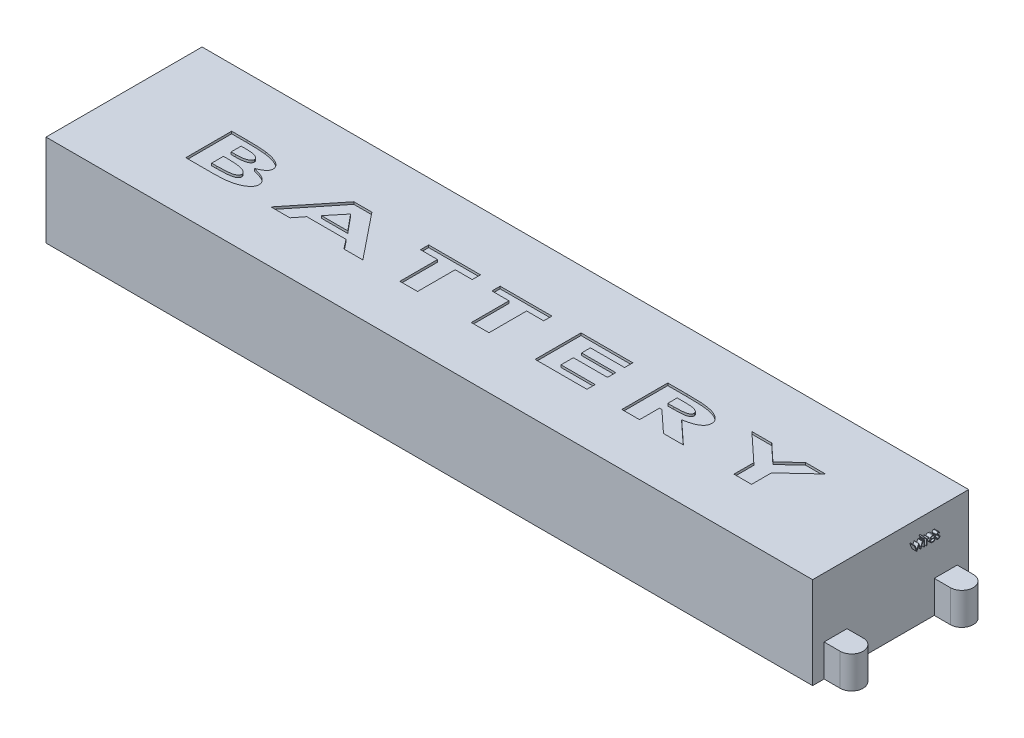
from build123d import *

# Parameters (mm, degrees)
SKETCH1_W           = 334
SKETCH1_H           = 68
BOSS_EXTRUDE1_DEPTH = 40
BOSS_EXTRUDE3_DEPTH = 14
SKETCH2_W           = 0.314102564
SKETCH2_H           = 2.557692308
BOSS_EXTRUDE2_DEPTH = 2
CUT_EXTRUDE1_DEPTH  = 1


with BuildPart() as part:
    # Sketch1 → Boss-Extrude1 (new body)
    with BuildSketch(Plane(origin=(0, 0, 0), x_dir=(1, 0, 0), z_dir=(0, 1, 0))):
        Rectangle(SKETCH1_W, SKETCH1_H)
    extrude(amount=BOSS_EXTRUDE1_DEPTH)

    # Sketch4 → Boss-Extrude3 (add)
    with BuildSketch(Plane(origin=(0, 0, 0), x_dir=(1, 0, 0), z_dir=(0, 1, 0))):
        with BuildLine():
            Line((167, -19), (174, -19))
            ThreePointArc((174, -19), (179, -24), (174, -29))
            Line((174, -29), (167, -29))
            Line((167, -29), (167, -19))
        make_face()
    boss_extrude3 = extrude(amount=BOSS_EXTRUDE3_DEPTH)

    # Mirror1: Boss-Extrude3 across plane
    add(boss_extrude3.mirror(Plane.XY))

    # Sketch2 → Boss-Extrude2 (add)
    # profile 1 of 6: a face of its own
    with BuildSketch(Plane(origin=(167, 0, 0), x_dir=(0, 0, -1), z_dir=(1, 0, 0))):
        Polygon((8.278846154, 32.557692308), (8.616085737, 32.557692308), (9.378205128, 30.717948718), (10.213241186, 32.557692308), (10.266526442, 32.557692308), (11.083333333, 30.717948718), (11.852463942, 32.557692308), (12.182692308, 32.557692308), (11.113481571, 30), (11.048277244, 30), (10.230769231, 31.83974359), (9.396434295, 30), (9.338241186, 30), align=None)
    # profile 2 of 6: a face of its own
    with BuildSketch(Plane(origin=(167, 0, 0), x_dir=(0, 0, -1), z_dir=(1, 0, 0))):
        with BuildLine():
            add(Edge.make_bspline(
                [(12.697315705, 33.634615385), (12.716807021, 33.633711232), (12.754974761, 33.631940728), (12.810168028, 33.616779251), (12.860425041, 33.591079566), (12.905002773, 33.556599885), (12.94325466, 33.516050441), (12.97003537, 33.468789473), (12.987247767, 33.417730834), (12.989326322, 33.382115745), (12.990384615, 33.363982372)],
                knots=[0, 0, 0, 0, 1.055194115, 2.066272739, 3.074728998, 4.095836921, 5.109056067, 6.073838105, 7.019297344, 8, 8, 8, 8], degree=3))
            add(Edge.make_bspline(
                [(12.990384615, 33.363982372), (12.989302456, 33.346319719), (12.987163154, 33.311402744), (12.970048665, 33.261229272), (12.943026428, 33.214624988), (12.905027302, 33.174154278), (12.860418541, 33.139693658), (12.810169755, 33.113988919), (12.754974307, 33.098828782), (12.716806867, 33.097058093), (12.697315705, 33.096153846)],
                knots=[0, 0, 0, 0, 0.96129708, 1.900370562, 2.859976407, 3.87933698, 4.906634145, 5.921202961, 6.938410037, 8, 8, 8, 8], degree=3))
            add(Edge.make_bspline(
                [(12.697315705, 33.096153846), (12.67804743, 33.097023566), (12.64054425, 33.098716363), (12.586177407, 33.114286381), (12.536348918, 33.139702454), (12.491684245, 33.173928639), (12.454454052, 33.214873536), (12.427355727, 33.26120083), (12.410280765, 33.311409985), (12.408136136, 33.346322151), (12.407051282, 33.363982372)],
                knots=[0, 0, 0, 0, 1.054934014, 2.053291228, 3.073705704, 4.106921865, 5.123545215, 6.088680038, 7.033164197, 8, 8, 8, 8], degree=3))
            add(Edge.make_bspline(
                [(12.407051282, 33.363982372), (12.408112369, 33.382113221), (12.41019641, 33.417723354), (12.427368526, 33.468818387), (12.454228334, 33.515799889), (12.491708897, 33.556825388), (12.536342357, 33.591070823), (12.586179103, 33.616481804), (12.640543802, 33.632053144), (12.678047278, 33.633745758), (12.697315705, 33.634615385)],
                knots=[0, 0, 0, 0, 0.98631895, 1.937192651, 2.907499808, 3.917963147, 4.944918757, 5.95915025, 6.951458133, 8, 8, 8, 8], degree=3))
        make_face()
    # profile 3 of 6: a face of its own
    with BuildSketch(Plane(origin=(167, 0, 0), x_dir=(0, 0, -1), z_dir=(1, 0, 0))):
        with Locations((12.698717949, 31.278846154)):
            Rectangle(SKETCH2_W, SKETCH2_H)
    # profile 4 of 6: a face of its own
    with BuildSketch(Plane(origin=(167, 0, 0), x_dir=(0, 0, -1), z_dir=(1, 0, 0))):
        with BuildLine():
            Line((13.528846154, 32.557692308), (13.842948718, 32.557692308))
            Line((13.842948718, 32.557692308), (13.842948718, 32.181189904))
            add(Edge.make_bspline(
                [(13.842948718, 32.181189904), (13.866137477, 32.216245732), (13.910485798, 32.283289731), (13.984198727, 32.371959032), (14.059702058, 32.445374079), (14.137357246, 32.503877598), (14.217735345, 32.547690717), (14.299072297, 32.579783752), (14.382647767, 32.598761067), (14.438809691, 32.601294726), (14.466947115, 32.602564103)],
                knots=[0, 0, 0, 0, 1.2804753, 2.448899062, 3.506932113, 4.484331642, 5.4025378, 6.288909075, 7.142734305, 8, 8, 8, 8], degree=3))
            add(Edge.make_bspline(
                [(14.466947115, 32.602564103), (14.488773442, 32.601373576), (14.533682527, 32.59892399), (14.601665117, 32.581713165), (14.671708569, 32.554235143), (14.716850956, 32.52839492), (14.740384615, 32.514923878)],
                knots=[0, 0, 0, 0, 0.901110191, 1.854092781, 2.881294221, 4, 4, 4, 4], degree=3))
            Line((14.740384615, 32.514923878), (14.567908654, 32.242888622))
            add(Edge.make_bspline(
                [(14.567908654, 32.242888622), (14.552799633, 32.249628888), (14.524119818, 32.262423203), (14.482165252, 32.277565213), (14.443483915, 32.286481129), (14.418840357, 32.287831847), (14.407351763, 32.288461538)],
                knots=[0, 0, 0, 0, 1.180555205, 2.24091978, 3.179933427, 4, 4, 4, 4], degree=3))
            add(Edge.make_bspline(
                [(14.407351763, 32.288461538), (14.382146029, 32.286781501), (14.330733639, 32.283354712), (14.25524914, 32.256415904), (14.182001934, 32.212890664), (14.123830272, 32.164619552), (14.078788019, 32.118071755), (14.046647794, 32.077423352), (14.017165047, 32.031844721), (13.988994826, 31.982115037), (13.963328532, 31.927385191), (13.939373863, 31.868201977), (13.917715, 31.804496849), (13.905364756, 31.760114328), (13.899038462, 31.737379808)],
                knots=[0, 0, 0, 0, 1.125678352, 2.296057538, 3.5422874, 4.923748041, 5.663163013, 6.437101912, 7.23742474, 8.08941207, 8.991984279, 9.93940061, 10.944477711, 12, 12, 12, 12], degree=3))
            add(Edge.make_bspline(
                [(13.899038462, 31.737379808), (13.894306068, 31.717102634), (13.883824176, 31.672190235), (13.873632639, 31.596841711), (13.863563121, 31.507818052), (13.856466502, 31.404871459), (13.84988846, 31.288259015), (13.846178378, 31.15780307), (13.843075237, 31.013369718), (13.842992171, 30.912395365), (13.842948718, 30.859575321)],
                knots=[0, 0, 0, 0, 0.566838948, 1.255505196, 2.06880316, 3.007127437, 4.065329342, 5.249902469, 6.561414163, 8, 8, 8, 8], degree=3))
            Line((13.842948718, 30.859575321), (13.842948718, 30))
            Line((13.842948718, 30), (13.528846154, 30))
            Line((13.528846154, 30), (13.528846154, 32.557692308))
        make_face()
    # profile 5 of 6: a face of its own
    with BuildSketch(Plane(origin=(167, 0, 0), x_dir=(0, 0, -1), z_dir=(1, 0, 0))):
        with BuildLine():
            Line((17.153645833, 30.807692308), (17.432692308, 30.661157853))
            add(Edge.make_bspline(
                [(17.432692308, 30.661157853), (17.410455712, 30.621714521), (17.367192104, 30.544973418), (17.292791356, 30.439541558), (17.214799283, 30.344693842), (17.129695315, 30.262964188), (17.040025637, 30.191712803), (16.945292982, 30.129374978), (16.845004164, 30.076256458), (16.739154439, 30.03150393), (16.626854888, 29.997094436), (16.507833372, 29.972790215), (16.381861876, 29.957766946), (16.295515696, 29.956021806), (16.251302083, 29.955128205)],
                knots=[0, 0, 0, 0, 1.120438281, 2.179929193, 3.190490725, 4.156257408, 5.095198341, 6.022838206, 6.959905092, 7.901321166, 8.864066838, 9.862729781, 10.905609505, 12, 12, 12, 12], degree=3))
            add(Edge.make_bspline(
                [(16.251302083, 29.955128205), (16.202160106, 29.95627538), (16.106298344, 29.958513187), (15.966758597, 29.977805652), (15.835379179, 30.00927801), (15.712167475, 30.053243552), (15.597425223, 30.110670876), (15.490924368, 30.180630358), (15.392104842, 30.262762612), (15.304080633, 30.357779056), (15.22483675, 30.459461013), (15.15491093, 30.565416898), (15.096453499, 30.675380122), (15.048900889, 30.788650646), (15.010496024, 30.90451454), (14.98372932, 31.024026007), (14.968299572, 31.146861592), (14.965935127, 31.229958927), (14.96474359, 31.271834936)],
                knots=[0, 0, 0, 0, 1.145258523, 2.234067595, 3.276747158, 4.290159414, 5.277019952, 6.260822364, 7.254936242, 8.264827045, 9.274100331, 10.257902744, 11.220704747, 12.172965371, 13.118907548, 14.062713208, 15.023725156, 16, 16, 16, 16], degree=3))
            add(Edge.make_bspline(
                [(14.96474359, 31.271834936), (14.965802731, 31.311129766), (14.967901809, 31.389006931), (14.981132597, 31.504272476), (15.00458089, 31.616300928), (15.036757214, 31.725185376), (15.07830846, 31.83074351), (15.129140679, 31.933039574), (15.189333057, 32.031964713), (15.235805731, 32.094367847), (15.259214744, 32.125801282)],
                knots=[0, 0, 0, 0, 1.024358464, 2.0301432, 3.019427413, 4.004406732, 4.986367066, 5.972626655, 6.978780325, 8, 8, 8, 8], degree=3))
            add(Edge.make_bspline(
                [(15.259214744, 32.125801282), (15.290922426, 32.163670152), (15.353333373, 32.238208303), (15.458889728, 32.336146628), (15.573189925, 32.418190404), (15.694801551, 32.48619754), (15.825138025, 32.537871187), (15.962447316, 32.576378769), (16.108292902, 32.59795678), (16.207998123, 32.601004614), (16.259014423, 32.602564103)],
                knots=[0, 0, 0, 0, 1.030682036, 2.02871468, 2.997146059, 3.962720338, 4.930598197, 5.918074684, 6.934738563, 8, 8, 8, 8], degree=3))
            add(Edge.make_bspline(
                [(16.259014423, 32.602564103), (16.311462028, 32.601210054), (16.414352274, 32.598553718), (16.564384395, 32.573927385), (16.706345112, 32.53487483), (16.840177616, 32.47972104), (16.965895477, 32.408561488), (17.082681527, 32.320419647), (17.192533039, 32.218001559), (17.256441618, 32.13923835), (17.28896234, 32.099158654)],
                knots=[0, 0, 0, 0, 1.056321875, 2.072262726, 3.055038591, 4.01806755, 4.982017516, 5.957941055, 6.960871419, 8, 8, 8, 8], degree=3))
            add(Edge.make_bspline(
                [(17.28896234, 32.099158654), (17.311089278, 32.068955072), (17.355195871, 32.008748954), (17.410442971, 31.910577797), (17.458400366, 31.807867202), (17.496733327, 31.698956905), (17.527772828, 31.585137325), (17.550229647, 31.46559478), (17.563399266, 31.340364869), (17.565987963, 31.255038314), (17.567307692, 31.211538462)],
                knots=[0, 0, 0, 0, 0.94817472, 1.890038105, 2.849395472, 3.817997239, 4.812318967, 5.836947057, 6.897266129, 8, 8, 8, 8], degree=3))
            Line((17.567307692, 31.211538462), (15.278846154, 31.211538462))
            add(Edge.make_bspline(
                [(15.278846154, 31.211538462), (15.28038576, 31.177837997), (15.283413334, 31.111567394), (15.297528477, 31.01459661), (15.319777251, 30.922223268), (15.351046314, 30.835140226), (15.388913159, 30.752210099), (15.435298876, 30.674048062), (15.49063843, 30.601010132), (15.552364129, 30.532442994), (15.621071225, 30.471382233), (15.693353972, 30.416730457), (15.770247537, 30.37092486), (15.85114562, 30.33374497), (15.935917405, 30.304638654), (16.0245896, 30.284770834), (16.116987717, 30.271463727), (16.179973451, 30.269984061), (16.212039263, 30.269230769)],
                knots=[0, 0, 0, 0, 1.094153842, 2.151609401, 3.174256925, 4.172055639, 5.149267565, 6.128595816, 7.11444997, 8.118368179, 9.117203808, 10.09244225, 11.054858984, 12.015122123, 12.976791628, 13.957293641, 14.960065497, 16, 16, 16, 16], degree=3))
            add(Edge.make_bspline(
                [(16.212039263, 30.269230769), (16.24339041, 30.269838826), (16.305597101, 30.271045327), (16.398237959, 30.282777238), (16.489377486, 30.301747513), (16.578638469, 30.327637504), (16.664209315, 30.359214356), (16.743454865, 30.397317213), (16.816335081, 30.43946696), (16.884452048, 30.487676635), (16.950523041, 30.546684822), (17.016065527, 30.620320543), (17.086342181, 30.707408071), (17.130331773, 30.772953737), (17.153645833, 30.807692308)],
                knots=[0, 0, 0, 0, 0.99110716, 1.966546729, 2.947904876, 3.932708344, 4.903319531, 5.828989031, 6.710028674, 7.56322171, 8.463672341, 9.504779593, 10.677557249, 12, 12, 12, 12], degree=3))
        make_face()
        with BuildLine():
            add(Edge.make_bspline(
                [(17.253205128, 31.525641026), (17.241708504, 31.567303899), (17.219581202, 31.64749152), (17.173344838, 31.75853241), (17.121273297, 31.857220311), (17.059651566, 31.942799944), (16.98983284, 32.018803457), (16.909187657, 32.085222043), (16.818751764, 32.144639494), (16.718992623, 32.194791993), (16.613350838, 32.237481852), (16.502744646, 32.266106968), (16.389886858, 32.28571651), (16.313552572, 32.287542618), (16.275140224, 32.288461538)],
                knots=[0, 0, 0, 0, 1.154881502, 2.222775134, 3.210006277, 4.132804581, 5.035138423, 5.962687519, 6.919655026, 7.923214229, 8.944639381, 9.960483929, 10.97369054, 12, 12, 12, 12], degree=3))
            add(Edge.make_bspline(
                [(16.275140224, 32.288461538), (16.243790786, 32.287849867), (16.181819537, 32.286640721), (16.090518469, 32.275170592), (16.00283877, 32.256210747), (15.918133482, 32.23024579), (15.837512614, 32.195637188), (15.759317845, 32.155053961), (15.685537449, 32.105512377), (15.639396154, 32.067753522), (15.616085737, 32.048677885)],
                knots=[0, 0, 0, 0, 1.04873581, 2.073130211, 3.073294108, 4.04793562, 5.032784715, 6.005352987, 6.992311501, 8, 8, 8, 8], degree=3))
            add(Edge.make_bspline(
                [(15.616085737, 32.048677885), (15.599392455, 32.033583569), (15.565609321, 32.003036353), (15.520468799, 31.950407146), (15.477248327, 31.893655584), (15.437914674, 31.83061046), (15.401837088, 31.761989681), (15.36807711, 31.688372045), (15.337690698, 31.609198915), (15.320594588, 31.554026476), (15.311798878, 31.525641026)],
                knots=[0, 0, 0, 0, 0.879870761, 1.780643979, 2.707998968, 3.669668524, 4.684282772, 5.740141944, 6.837334558, 8, 8, 8, 8], degree=3))
            Line((15.311798878, 31.525641026), (17.253205128, 31.525641026))
        make_face(mode=Mode.SUBTRACT)
    # profile 6 of 6: a face of its own
    with BuildSketch(Plane(origin=(167, 0, 0), x_dir=(0, 0, -1), z_dir=(1, 0, 0))):
        with BuildLine():
            Line((19.407051282, 32.238681891), (19.193910256, 32.019230769))
            add(Edge.make_bspline(
                [(19.193910256, 32.019230769), (19.175519753, 32.040543916), (19.140065027, 32.081633153), (19.083833546, 32.136570219), (19.027809943, 32.182707158), (18.972761129, 32.221659417), (18.91730286, 32.251108564), (18.862085942, 32.272603426), (18.807053203, 32.285905231), (18.770267168, 32.28761967), (18.752203526, 32.288461538)],
                knots=[0, 0, 0, 0, 1.26578478, 2.440284043, 3.530471711, 4.527705817, 5.468200915, 6.346673037, 7.188140097, 8, 8, 8, 8], degree=3))
            add(Edge.make_bspline(
                [(18.752203526, 32.288461538), (18.730064136, 32.287386665), (18.68649695, 32.285271468), (18.624071132, 32.264158037), (18.566120507, 32.231749299), (18.515963527, 32.185780715), (18.473475846, 32.133016446), (18.442462165, 32.074020122), (18.423496182, 32.010572078), (18.42109145, 31.96654222), (18.419871795, 31.944210737)],
                knots=[0, 0, 0, 0, 0.99966794, 1.967205029, 2.953328237, 3.988086729, 5.028030931, 6.008226631, 6.989793394, 8, 8, 8, 8], degree=3))
            add(Edge.make_bspline(
                [(18.419871795, 31.944210737), (18.420982607, 31.923998693), (18.4232011, 31.883631582), (18.44044778, 31.824083548), (18.467913852, 31.76602651), (18.493584046, 31.730463604), (18.506810897, 31.712139423)],
                knots=[0, 0, 0, 0, 0.960159726, 1.917612774, 2.927026955, 4, 4, 4, 4], degree=3))
            add(Edge.make_bspline(
                [(18.506810897, 31.712139423), (18.514774391, 31.702354839), (18.531723684, 31.681529584), (18.563532199, 31.652625731), (18.599554702, 31.62068348), (18.64287464, 31.588746643), (18.691625667, 31.555114918), (18.746864952, 31.521112785), (18.806839457, 31.48414836), (18.849776763, 31.460703924), (18.872095353, 31.448517628)],
                knots=[0, 0, 0, 0, 0.66740084, 1.420478572, 2.27185888, 3.217733974, 4.268547843, 5.408967954, 6.65319498, 8, 8, 8, 8], degree=3))
            add(Edge.make_bspline(
                [(18.872095353, 31.448517628), (18.89930893, 31.433272725), (18.9518766, 31.403824593), (19.026569367, 31.358114889), (19.094356408, 31.312683465), (19.155812076, 31.268016191), (19.209753884, 31.222863324), (19.257818437, 31.178955567), (19.298806881, 31.134966258), (19.321760808, 31.104233145), (19.332732372, 31.089543269)],
                knots=[0, 0, 0, 0, 1.27191281, 2.456916733, 3.569705269, 4.599008579, 5.553216877, 6.436649441, 7.252746552, 8, 8, 8, 8], degree=3))
            add(Edge.make_bspline(
                [(19.332732372, 31.089543269), (19.350942899, 31.059877181), (19.387185229, 31.00083616), (19.425243495, 30.903617733), (19.44730377, 30.80050723), (19.45036599, 30.72997501), (19.451923077, 30.694110577)],
                knots=[0, 0, 0, 0, 0.995354457, 1.980940102, 2.973342416, 4, 4, 4, 4], degree=3))
            add(Edge.make_bspline(
                [(19.451923077, 30.694110577), (19.451203543, 30.668841431), (19.449785623, 30.619045818), (19.439927556, 30.545710988), (19.42297258, 30.47557643), (19.399878826, 30.407881146), (19.368694453, 30.343922206), (19.332146656, 30.282085957), (19.288271744, 30.223710026), (19.238180368, 30.168871066), (19.183334875, 30.118785319), (19.124828736, 30.074761365), (19.062589906, 30.038187028), (18.997063104, 30.007921682), (18.92809945, 29.983853424), (18.855688161, 29.967190893), (18.780059406, 29.957218132), (18.728629598, 29.955833656), (18.702423878, 29.955128205)],
                knots=[0, 0, 0, 0, 1.032770009, 2.035186124, 3.017557409, 3.978232242, 4.952395191, 5.920591857, 6.910227898, 7.931268572, 8.952309245, 9.941945286, 10.918353717, 11.897095711, 12.887975737, 13.898235213, 14.929059601, 16, 16, 16, 16], degree=3))
            add(Edge.make_bspline(
                [(18.702423878, 29.955128205), (18.667056703, 29.956120905), (18.596813776, 29.958092513), (18.492924057, 29.976598574), (18.391403298, 30.005393968), (18.293019758, 30.045109902), (18.199973644, 30.095260615), (18.114842719, 30.155323008), (18.037331257, 30.223313006), (17.993212983, 30.275425916), (17.971153846, 30.301482372)],
                knots=[0, 0, 0, 0, 1.013940152, 2.01379169, 3.017749504, 4.037548394, 5.051665909, 6.043208538, 7.021604269, 8, 8, 8, 8], degree=3))
            Line((17.971153846, 30.301482372), (18.179387019, 30.538461538))
            add(Edge.make_bspline(
                [(18.179387019, 30.538461538), (18.199159432, 30.517106774), (18.237491244, 30.475707334), (18.298792461, 30.420582993), (18.361171862, 30.374381722), (18.424006549, 30.335738307), (18.488226643, 30.305962904), (18.553472257, 30.28504431), (18.619610682, 30.271600118), (18.664032817, 30.270021836), (18.686298077, 30.269230769)],
                knots=[0, 0, 0, 0, 1.179806542, 2.287233372, 3.337373186, 4.324005949, 5.273901747, 6.200048787, 7.097828587, 8, 8, 8, 8], degree=3))
            add(Edge.make_bspline(
                [(18.686298077, 30.269230769), (18.716616003, 30.270601594), (18.775852144, 30.273279956), (18.860695903, 30.297597048), (18.93903453, 30.335727), (19.007057875, 30.389811698), (19.064960036, 30.452767271), (19.106888211, 30.52368139), (19.133164386, 30.600472847), (19.136250385, 30.653705149), (19.137820513, 30.680789263)],
                knots=[0, 0, 0, 0, 1.072336372, 2.095165389, 3.102688358, 4.141489647, 5.156069229, 6.117746104, 7.042326257, 8, 8, 8, 8], degree=3))
            add(Edge.make_bspline(
                [(19.137820513, 30.680789263), (19.136734218, 30.703098881), (19.134589476, 30.747146237), (19.117746204, 30.810896578), (19.091133351, 30.871365859), (19.064928703, 30.906755506), (19.051582532, 30.924779647)],
                knots=[0, 0, 0, 0, 1.013901739, 2.00181326, 2.98231254, 4, 4, 4, 4], degree=3))
            add(Edge.make_bspline(
                [(19.051582532, 30.924779647), (19.043560138, 30.93381501), (19.026084465, 30.953497292), (18.994029224, 30.98192237), (18.955647362, 31.01256047), (18.910507199, 31.044892059), (18.858517737, 31.078490664), (18.799468261, 31.113180016), (18.734167709, 31.150607742), (18.687997078, 31.175427397), (18.663862179, 31.188401442)],
                knots=[0, 0, 0, 0, 0.615000592, 1.339693406, 2.178160186, 3.116406724, 4.166410947, 5.330106347, 6.604359322, 8, 8, 8, 8], degree=3))
            add(Edge.make_bspline(
                [(18.663862179, 31.188401442), (18.637815539, 31.202940574), (18.587302792, 31.23113659), (18.515755501, 31.275052671), (18.451208147, 31.319719945), (18.392107572, 31.362632784), (18.339946567, 31.406053728), (18.294930618, 31.45003098), (18.255287402, 31.492790966), (18.233339991, 31.523088263), (18.222856571, 31.537560096)],
                knots=[0, 0, 0, 0, 1.262093308, 2.447601706, 3.550203992, 4.582594899, 5.537233252, 6.418365656, 7.244515135, 8, 8, 8, 8], degree=3))
            add(Edge.make_bspline(
                [(18.222856571, 31.537560096), (18.204725971, 31.566705711), (18.168458436, 31.625007126), (18.133243244, 31.722317603), (18.109037216, 31.824762661), (18.106874825, 31.895449515), (18.105769231, 31.931590545)],
                knots=[0, 0, 0, 0, 0.985009483, 1.970363186, 2.962279964, 4, 4, 4, 4], degree=3))
            add(Edge.make_bspline(
                [(18.105769231, 31.931590545), (18.106303426, 31.955215943), (18.107348922, 32.001454194), (18.115692974, 32.069393014), (18.130884685, 32.133941168), (18.149939607, 32.196068031), (18.176422612, 32.254570125), (18.208068517, 32.310227596), (18.245255942, 32.362963514), (18.288099233, 32.411966646), (18.335205878, 32.456475972), (18.386100648, 32.4952746), (18.439638904, 32.528380955), (18.496047324, 32.556146116), (18.555867797, 32.577147498), (18.618682183, 32.591604883), (18.684363338, 32.601260086), (18.729264464, 32.602123171), (18.752203526, 32.602564103)],
                knots=[0, 0, 0, 0, 1.087655834, 2.128696564, 3.144119009, 4.137814668, 5.115653402, 6.093965665, 7.082169637, 8.081268856, 9.086088321, 10.061021666, 11.022561449, 11.980240094, 12.950172527, 13.934149372, 14.944599409, 16, 16, 16, 16], degree=3))
            add(Edge.make_bspline(
                [(18.752203526, 32.602564103), (18.779395589, 32.601459762), (18.834289811, 32.599230364), (18.916644437, 32.581524674), (18.998877779, 32.552391569), (19.081201129, 32.512155336), (19.163011418, 32.46008846), (19.245028275, 32.397159161), (19.328236305, 32.323781446), (19.380192618, 32.267682221), (19.407051282, 32.238681891)],
                knots=[0, 0, 0, 0, 0.845714091, 1.707292901, 2.609013841, 3.555613372, 4.552488639, 5.621697636, 6.770543573, 8, 8, 8, 8], degree=3))
        make_face()
    extrude(amount=BOSS_EXTRUDE2_DEPTH)

    # Sketch3 → Cut-Extrude1 (cut)
    # profile 1 of 7: a face of its own
    with BuildSketch(Plane(origin=(0, 40, 0), x_dir=(1, 0, 0), z_dir=(0, 1, 0))):
        with BuildLine():
            Line((-128.769230769, -11.333333333), (-128.769230769, 8.666666667))
            Line((-128.769230769, 8.666666667), (-122.138621795, 8.666666667))
            add(Edge.make_bspline(
                [(-122.138621795, 8.666666667), (-121.673868202, 8.666710349), (-120.776363255, 8.666794706), (-119.479598107, 8.644619916), (-118.279002801, 8.616498), (-117.175550768, 8.584284762), (-116.168704241, 8.529835025), (-115.260241877, 8.472029716), (-114.447742763, 8.402035062), (-113.940021711, 8.33951429), (-113.701121795, 8.310096154)],
                knots=[0, 0, 0, 0, 1.31998214, 2.549072282, 3.683500943, 4.730935446, 5.684263683, 6.547160721, 7.316390013, 8, 8, 8, 8], degree=3))
            add(Edge.make_bspline(
                [(-113.701121795, 8.310096154), (-113.393565068, 8.268604856), (-112.792635807, 8.187535796), (-111.919007274, 8.025502368), (-111.091768499, 7.841286884), (-110.312180795, 7.636710818), (-109.582330759, 7.398546569), (-108.901569636, 7.134955432), (-108.267047961, 6.84681245), (-107.683659307, 6.537052778), (-107.158508721, 6.206781648), (-106.700305314, 5.85921377), (-106.310074219, 5.498334926), (-105.993304393, 5.118601701), (-105.746143146, 4.723646464), (-105.565445056, 4.314467501), (-105.457345924, 3.887211145), (-105.443073171, 3.596485185), (-105.435897436, 3.450320513)],
                knots=[0, 0, 0, 0, 1.444239864, 2.821872898, 4.133831976, 5.388239239, 6.571533518, 7.705033956, 8.784268754, 9.813142222, 10.777069403, 11.668425098, 12.486344434, 13.245570479, 13.963067819, 14.647834093, 15.320188377, 16, 16, 16, 16], degree=3))
            add(Edge.make_bspline(
                [(-105.435897436, 3.450320513), (-105.438888653, 3.355287434), (-105.44482579, 3.166660394), (-105.495478226, 2.887122704), (-105.575121064, 2.614069146), (-105.688596966, 2.348137995), (-105.834556803, 2.088532569), (-106.015789574, 1.838224556), (-106.22627099, 1.591866323), (-106.467236552, 1.350406603), (-106.747187437, 1.115518927), (-107.069549574, 0.890862451), (-107.424806028, 0.659783128), (-107.826129255, 0.44135007), (-108.264132119, 0.219840706), (-108.746959339, 0.011519705), (-109.264609316, -0.204642144), (-109.62733528, -0.335947222), (-109.814903846, -0.403846154)],
                knots=[0, 0, 0, 0, 0.73412892, 1.457140681, 2.188870362, 2.928999352, 3.687054493, 4.486307402, 5.313796769, 6.189772561, 7.120317905, 8.134385744, 9.225455312, 10.39460865, 11.664228043, 13.018493101, 14.458238366, 16, 16, 16, 16], degree=3))
            add(Edge.make_bspline(
                [(-109.814903846, -0.403846154), (-109.513950512, -0.475427717), (-108.929925472, -0.614337709), (-108.08942069, -0.846768876), (-107.309326508, -1.08972295), (-106.592879759, -1.349445313), (-105.938647222, -1.621172777), (-105.346622579, -1.903641002), (-104.820156442, -2.205327239), (-104.352638749, -2.516753273), (-103.943893428, -2.843945545), (-103.58809847, -3.183490182), (-103.290877036, -3.542680859), (-103.041480465, -3.912238985), (-102.85328081, -4.300246965), (-102.713915871, -4.700290175), (-102.632174814, -5.117417754), (-102.621021739, -5.400826555), (-102.615384615, -5.544070513)],
                knots=[0, 0, 0, 0, 1.560057579, 3.027421822, 4.397137032, 5.679779435, 6.869333915, 7.968857049, 8.985549996, 9.927045053, 10.799049465, 11.623096799, 12.402674743, 13.146153443, 13.86607283, 14.571093087, 15.277784314, 16, 16, 16, 16], degree=3))
            add(Edge.make_bspline(
                [(-102.615384615, -5.544070513), (-102.620836364, -5.682023659), (-102.631735767, -5.957826363), (-102.718768396, -6.367155202), (-102.865350153, -6.764408589), (-103.064882598, -7.154999787), (-103.321357332, -7.534678038), (-103.640453062, -7.902276573), (-104.012576709, -8.260557292), (-104.437415999, -8.608733618), (-104.908108205, -8.935332663), (-105.409654817, -9.251558883), (-105.949337855, -9.538610299), (-106.520252449, -9.806223726), (-107.12502911, -10.0514009), (-107.761862984, -10.274422458), (-108.430968423, -10.479616505), (-109.139674916, -10.660378172), (-109.898179993, -10.823359412), (-110.721333903, -10.954695371), (-111.608897842, -11.078697989), (-112.567859605, -11.165367347), (-113.593364032, -11.244083004), (-114.68899222, -11.293159981), (-115.851024291, -11.326190747), (-116.648478635, -11.330907957), (-117.05849359, -11.333333333)],
                knots=[0, 0, 0, 0, 0.590042084, 1.17964111, 1.781712407, 2.397728595, 3.052407878, 3.737419508, 4.477092177, 5.260849838, 6.08539125, 6.92749391, 7.796908267, 8.699467972, 9.624953763, 10.588414995, 11.586399601, 12.619129434, 13.717672503, 14.90533072, 16.185677954, 17.552275451, 19.025136816, 20.58720367, 22.245294487, 24, 24, 24, 24], degree=3))
            Line((-117.05849359, -11.333333333), (-128.769230769, -11.333333333))
        make_face()
        with BuildLine():
            Line((-121.076923077, 5.076923077), (-121.076923077, 0.717948718))
            Line((-121.076923077, 0.717948718), (-119.225961538, 0.717948718))
            add(Edge.make_bspline(
                [(-119.225961538, 0.717948718), (-118.976199322, 0.719057602), (-118.493863352, 0.721199059), (-117.79505089, 0.749641591), (-117.145477027, 0.796307137), (-116.545574003, 0.864678889), (-115.994349272, 0.947108813), (-115.493555697, 1.049499396), (-115.042959971, 1.174161866), (-114.640738326, 1.313153767), (-114.286041758, 1.468384708), (-113.978281015, 1.641136044), (-113.718210262, 1.827313217), (-113.503270405, 2.026549031), (-113.336341959, 2.241440112), (-113.212839281, 2.470577389), (-113.142932035, 2.717150925), (-113.133138085, 2.885006709), (-113.128205128, 2.969551282)],
                knots=[0, 0, 0, 0, 1.704654372, 3.291995604, 4.772716245, 6.148760897, 7.412139669, 8.575936087, 9.635231733, 10.600978065, 11.478367912, 12.274325297, 13.005481925, 13.656761961, 14.267553572, 14.854693493, 15.423139034, 16, 16, 16, 16], degree=3))
            add(Edge.make_bspline(
                [(-113.128205128, 2.969551282), (-113.133471912, 3.048696227), (-113.143911037, 3.20556692), (-113.208220428, 3.435018858), (-113.326667562, 3.646890314), (-113.482966789, 3.848967378), (-113.689821733, 4.032979387), (-113.934483062, 4.211736704), (-114.229622919, 4.367543598), (-114.564216973, 4.518501666), (-114.945807273, 4.648056105), (-115.372643036, 4.764068887), (-115.846013466, 4.863973507), (-116.366443518, 4.942692251), (-116.933437357, 5.001383227), (-117.54542053, 5.044376303), (-118.204039905, 5.073891338), (-118.658352054, 5.075889273), (-118.893429487, 5.076923077)],
                knots=[0, 0, 0, 0, 0.573248763, 1.13621826, 1.707098723, 2.320047212, 2.976781728, 3.703807878, 4.508430471, 5.386834626, 6.358951356, 7.421225169, 8.587157953, 9.858551474, 11.229180048, 12.711929957, 14.298634394, 16, 16, 16, 16], degree=3))
            Line((-118.893429487, 5.076923077), (-121.076923077, 5.076923077))
        make_face(mode=Mode.SUBTRACT)
        with BuildLine():
            Line((-121.076923077, -2.615384615), (-121.076923077, -7.743589744))
            Line((-121.076923077, -7.743589744), (-119.009615385, -7.743589744))
            add(Edge.make_bspline(
                [(-119.009615385, -7.743589744), (-118.599610936, -7.742461888), (-117.814217086, -7.740301398), (-116.688135035, -7.71284272), (-115.666326276, -7.664660765), (-114.748287476, -7.6029358), (-113.935381769, -7.521467269), (-113.227161354, -7.416829647), (-112.622291047, -7.30224352), (-112.112995328, -7.160865499), (-111.687439479, -6.997598966), (-111.320570087, -6.826229381), (-111.009119164, -6.635141016), (-110.754766725, -6.42356481), (-110.555183826, -6.194228932), (-110.412595543, -5.947254806), (-110.323287595, -5.68090715), (-110.312917004, -5.496666475), (-110.307692308, -5.403846154)],
                knots=[0, 0, 0, 0, 2.042760453, 3.913058762, 5.611655864, 7.13909107, 8.497020976, 9.680799424, 10.705160778, 11.562468973, 12.310096949, 12.973778225, 13.577516776, 14.125315016, 14.616075177, 15.084022435, 15.538531152, 16, 16, 16, 16], degree=3))
            add(Edge.make_bspline(
                [(-110.307692308, -5.403846154), (-110.313257964, -5.297460726), (-110.324298497, -5.086425087), (-110.432562481, -4.782498116), (-110.600381513, -4.497757696), (-110.833216425, -4.231290324), (-111.132272772, -3.985445707), (-111.496053359, -3.759009609), (-111.924400259, -3.547006763), (-112.421082572, -3.350368626), (-112.994127167, -3.174355608), (-113.650414006, -3.024178608), (-114.391594598, -2.897833257), (-115.219388528, -2.796557533), (-116.133018976, -2.710641267), (-117.134167093, -2.659536811), (-118.221389258, -2.62108716), (-118.974852747, -2.617333953), (-119.366185897, -2.615384615)],
                knots=[0, 0, 0, 0, 0.501495216, 0.994810717, 1.507164792, 2.057939335, 2.658765087, 3.331591524, 4.080080005, 4.916289717, 5.85519198, 6.912262741, 8.098025072, 9.409389306, 10.855473132, 12.436881987, 14.149391157, 16, 16, 16, 16], degree=3))
            Line((-119.366185897, -2.615384615), (-121.076923077, -2.615384615))
        make_face(mode=Mode.SUBTRACT)
    # profile 2 of 7: a face of its own
    with BuildSketch(Plane(origin=(0, 40, 0), x_dir=(1, 0, 0), z_dir=(0, 1, 0))):
        Polygon((-75.541666667, 8.666666667), (-67.685096154, 8.666666667), (-51.615384615, -11.333333333), (-59.856570513, -11.333333333), (-63.073717949, -7.230769231), (-80.157051282, -7.230769231), (-83.378205128, -11.333333333), (-91.615384615, -11.333333333), align=None)
        Polygon((-71.615384615, 3.302083333), (-77.340544872, -3.641025641), (-65.890224359, -3.641025641), align=None, mode=Mode.SUBTRACT)
    # profile 3 of 7: a face of its own
    with BuildSketch(Plane(origin=(0, 40, 0), x_dir=(1, 0, 0), z_dir=(0, 1, 0))):
        Polygon((-42.923076923, 8.666666667), (-20.358974359, 8.666666667), (-20.358974359, 5.076923077), (-27.794871795, 5.076923077), (-27.794871795, -11.333333333), (-35.487179487, -11.333333333), (-35.487179487, 5.076923077), (-42.923076923, 5.076923077), align=None)
    # profile 4 of 7: a face of its own
    with BuildSketch(Plane(origin=(0, 40, 0), x_dir=(1, 0, 0), z_dir=(0, 1, 0))):
        Polygon((-11.794871795, 8.666666667), (10.769230769, 8.666666667), (10.769230769, 5.076923077), (3.333333333, 5.076923077), (3.333333333, -11.333333333), (-4.358974359, -11.333333333), (-4.358974359, 5.076923077), (-11.794871795, 5.076923077), align=None)
    # profile 5 of 7: a face of its own
    with BuildSketch(Plane(origin=(0, 40, 0), x_dir=(1, 0, 0), z_dir=(0, 1, 0))):
        Polygon((23.435897436, 8.666666667), (46, 8.666666667), (46, 5.076923077), (31.128205128, 5.076923077), (31.128205128, 1.230769231), (46, 1.230769231), (46, -2.358974359), (31.128205128, -2.358974359), (31.128205128, -7.743589744), (46, -7.743589744), (46, -11.333333333), (23.435897436, -11.333333333), align=None)
    # profile 6 of 7: a face of its own
    with BuildSketch(Plane(origin=(0, 40, 0), x_dir=(1, 0, 0), z_dir=(0, 1, 0))):
        with BuildLine():
            Line((61.230769231, 8.666666667), (69.684294872, 8.666666667))
            add(Edge.make_bspline(
                [(69.684294872, 8.666666667), (69.968748271, 8.665151665), (70.526971612, 8.662178562), (71.348337965, 8.660856006), (72.137590934, 8.647230508), (72.896163095, 8.631806162), (73.622654169, 8.611335373), (74.318608909, 8.589370963), (74.983415828, 8.55402526), (75.618127116, 8.525661352), (76.220293357, 8.483829439), (76.790593253, 8.440161765), (77.330193318, 8.392370982), (77.839084685, 8.340550789), (78.317238823, 8.284396642), (78.763419922, 8.224880003), (79.179304857, 8.161895769), (79.684524513, 8.065328769), (80.28217151, 7.936578237), (80.96579164, 7.75774218), (81.6129418, 7.553044546), (82.223190661, 7.325300807), (82.798012382, 7.071763342), (83.338765784, 6.797683115), (83.841591288, 6.49564958), (84.305856036, 6.173010357), (84.724716723, 5.83109554), (85.094964485, 5.473917172), (85.403489558, 5.09611962), (85.660014123, 4.705151892), (85.858586738, 4.297295342), (85.998762635, 3.874280863), (86.087275162, 3.435294391), (86.097419411, 3.136905759), (86.102564103, 2.985576923)],
                knots=[0, 0, 0, 0, 1.447747822, 2.841121361, 4.180258665, 5.46515348, 6.702649317, 7.87921363, 9.008802404, 10.090870714, 11.112663307, 12.080709401, 13.001903797, 13.869615965, 14.68402087, 15.452066414, 16.160539564, 16.824409067, 18.069589957, 19.271424528, 20.419309892, 21.522685964, 22.58478148, 23.615263057, 24.606067619, 25.567697667, 26.490195027, 27.35534788, 28.181243678, 28.967391338, 29.730397892, 30.482672798, 31.23048221, 32, 32, 32, 32], degree=3))
            add(Edge.make_bspline(
                [(86.102564103, 2.985576923), (86.096331466, 2.827516952), (86.084021857, 2.5153447), (85.988060911, 2.058439357), (85.836017127, 1.620525699), (85.615115574, 1.203569873), (85.333588245, 0.80762937), (84.991079207, 0.431032276), (84.589603656, 0.073165435), (84.119309637, -0.256524227), (83.594307159, -0.576067599), (83.001192376, -0.863918049), (82.351963254, -1.143445877), (81.635187481, -1.391887553), (80.859086631, -1.628578112), (80.019372183, -1.843832589), (79.11863889, -2.040267569), (78.494816576, -2.150182662), (78.173878205, -2.206730769)],
                knots=[0, 0, 0, 0, 0.738510582, 1.4585762, 2.173479213, 2.89966467, 3.656763107, 4.439287494, 5.275198475, 6.165849881, 7.121074261, 8.14592728, 9.245426128, 10.424461814, 11.690624821, 13.03852549, 14.476407813, 16, 16, 16, 16], degree=3))
            Line((78.173878205, -2.206730769), (88.025641026, -11.333333333))
            Line((88.025641026, -11.333333333), (79.363782051, -11.333333333))
            Line((79.363782051, -11.333333333), (69.952724359, -2.615384615))
            Line((69.952724359, -2.615384615), (68.923076923, -2.615384615))
            Line((68.923076923, -2.615384615), (68.923076923, -11.333333333))
            Line((68.923076923, -11.333333333), (61.230769231, -11.333333333))
            Line((61.230769231, -11.333333333), (61.230769231, 8.666666667))
        make_face()
        with BuildLine():
            Line((68.923076923, 0.974358974), (71.507211538, 0.974358974))
            add(Edge.make_bspline(
                [(71.507211538, 0.974358974), (71.822385002, 0.976304855), (72.427424303, 0.980040368), (73.297176219, 0.996934231), (74.090524223, 1.038481453), (74.806519227, 1.089845694), (75.447381331, 1.150230953), (76.009724065, 1.235143724), (76.497641251, 1.32783652), (76.912875368, 1.44066368), (77.267542059, 1.56896065), (77.571487079, 1.71587213), (77.827530996, 1.887168239), (78.043832543, 2.072355056), (78.207268731, 2.286570691), (78.325718337, 2.516743279), (78.396784537, 2.769121351), (78.405676283, 2.943718884), (78.41025641, 3.033653846)],
                knots=[0, 0, 0, 0, 1.941146161, 3.726423238, 5.35702916, 6.833163903, 8.147527669, 9.320030401, 10.334631107, 11.204606299, 11.967041687, 12.654891231, 13.277652523, 13.860286715, 14.399880292, 14.925888225, 15.446726421, 16, 16, 16, 16], degree=3))
            add(Edge.make_bspline(
                [(78.41025641, 3.033653846), (78.402391158, 3.140822064), (78.386453823, 3.357976682), (78.231547579, 3.6625598), (77.994082988, 3.942320529), (77.665465384, 4.187764319), (77.267567191, 4.410657161), (76.803554985, 4.602508155), (76.276666742, 4.755841884), (75.790002559, 4.855876426), (75.344706907, 4.916901769), (74.940042996, 4.961445034), (74.472173482, 4.994796994), (73.939424575, 5.028455055), (73.342287248, 5.050888377), (72.679837465, 5.067012234), (71.95460623, 5.073692696), (71.44978652, 5.075816337), (71.186698718, 5.076923077)],
                knots=[0, 0, 0, 0, 0.635787271, 1.288293716, 1.995563529, 2.813518098, 3.720151647, 4.71346607, 5.80296468, 6.991050822, 7.675307862, 8.485143574, 9.420510408, 10.47461831, 11.671230475, 12.986838517, 14.42968486, 16, 16, 16, 16], degree=3))
            Line((71.186698718, 5.076923077), (68.923076923, 5.076923077))
            Line((68.923076923, 5.076923077), (68.923076923, 0.974358974))
        make_face(mode=Mode.SUBTRACT)
    # profile 7 of 7: a face of its own
    with BuildSketch(Plane(origin=(0, 40, 0), x_dir=(1, 0, 0), z_dir=(0, 1, 0))):
        Polygon((97.871794872, 8.666666667), (106.529647436, 8.666666667), (113.901442308, 1.803685897), (121.269230769, 8.666666667), (129.923076923, 8.666666667), (117.743589744, -2.671474359), (117.743589744, -11.333333333), (110.051282051, -11.333333333), (110.051282051, -2.671474359), align=None)
    extrude(amount=-CUT_EXTRUDE1_DEPTH, mode=Mode.SUBTRACT)


solid = part.part
